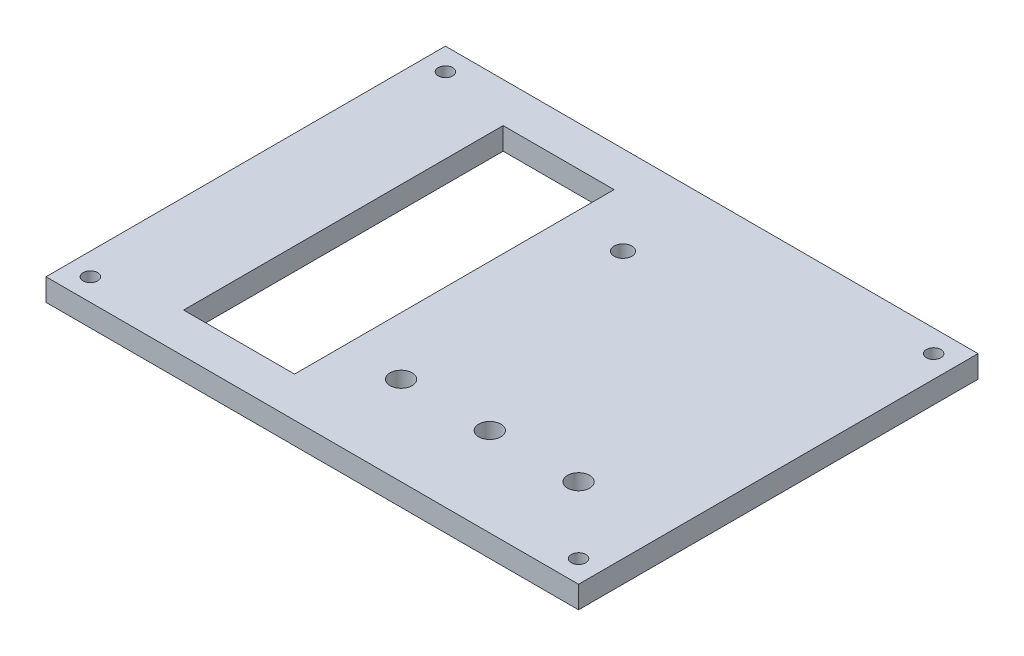
from build123d import *

# Parameters (mm, degrees)
SKETCH1_W                                      = 120
SKETCH1_H                                      = 90
BOSS_EXTRUDE1_DEPTH                            = 5
CSK_FOR_4_FLAT_HEAD_MACHINE_SCREW1_D           = 3.2639
CSK_FOR_4_FLAT_HEAD_MACHINE_SCREW1_CSINK_D     = 5.715
CSK_FOR_4_FLAT_HEAD_MACHINE_SCREW1_CSINK_ANGLE = 82
SKETCH5_R                                      = 2.5
SKETCH5_W                                      = 25
SKETCH5_H                                      = 72
CUT_EXTRUDE3_DEPTH                             = 76.166481892
SKETCH6_R                                      = 2
CUT_EXTRUDE4_DEPTH                             = 5


with BuildPart() as part:
    # Sketch1 → Boss-Extrude1 (new body)
    with BuildSketch(Plane(origin=(0, 0, 0), x_dir=(1, 0, 0), z_dir=(0, 1, 0))):
        Rectangle(SKETCH1_W, SKETCH1_H)
    extrude(amount=BOSS_EXTRUDE1_DEPTH)

    # CSK for #4 Flat Head Machine Screw1 (through all)
    with Locations(Plane(origin=(0, 0, 0), x_dir=(-1, 0, 0), z_dir=(0, -1, 0))):
        with Locations((-55, 40), (-55, -40), (55, -40), (55, 40)):
            CounterSinkHole(CSK_FOR_4_FLAT_HEAD_MACHINE_SCREW1_D / 2, CSK_FOR_4_FLAT_HEAD_MACHINE_SCREW1_CSINK_D / 2, counter_sink_angle=CSK_FOR_4_FLAT_HEAD_MACHINE_SCREW1_CSINK_ANGLE)

    # Sketch5 → Cut-Extrude3 (cut, through all)
    with BuildSketch(Plane(origin=(0, 5, 0), x_dir=(1, 0, 0), z_dir=(0, 1, 0))):
        with Locations(Location((0, -25, 0), (0, 0, 270))):
            Circle(SKETCH5_R)
        with Locations(Location((20, -25, 0), (0, 0, 270))):
            Circle(SKETCH5_R)
        with Locations(Location((40, -25, 0), (0, 0, 270))):
            Circle(SKETCH5_R)
        with Locations((-25.5, 0)):
            Rectangle(SKETCH5_W, SKETCH5_H)
    extrude(amount=-CUT_EXTRUDE3_DEPTH, mode=Mode.SUBTRACT)

    # Sketch6 → Cut-Extrude4 (cut)
    with BuildSketch(Plane(origin=(0, 5, 0), x_dir=(1, 0, 0), z_dir=(0, 1, 0))):
        with Locations(Location((0, 25, 0), (0, 0, 270))):
            Circle(SKETCH6_R)
    extrude(amount=-CUT_EXTRUDE4_DEPTH, mode=Mode.SUBTRACT)


solid = part.part
